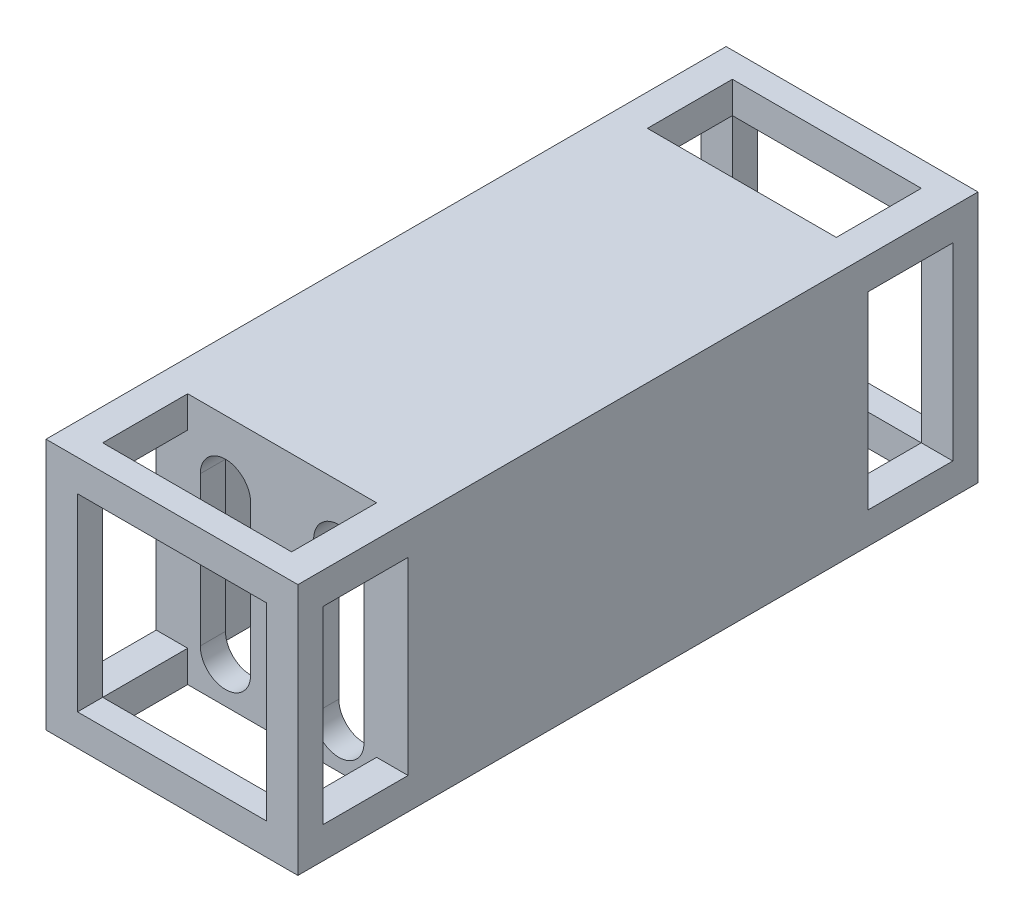
from build123d import *

# Parameters (mm, degrees)
RESSALTO_EXTRUS_O1_DEPTH = 65
ESBO_O2_W                = 40
ESBO_O2_H                = 40
RESSALTO_EXTRUS_O2_DEPTH = 4
ESBO_O4_W                = 5
ESBO_O4_H                = 5
RESSALTO_EXTRUS_O3_DEPTH = 13.5
ESBO_O5_W                = 40
ESBO_O5_H                = 40
ESBO_O5_W_2              = 30
ESBO_O5_H_2              = 30
RESSALTO_EXTRUS_O4_DEPTH = 4


with BuildPart() as part:
    # Esboço1 → Ressalto-extrusão1 (new body)
    with BuildSketch(Plane.XY):
        with BuildLine():
            Line((18, 0), (20, 0))
            Line((20, 0), (20, 40))
            Line((20, 40), (-20, 40))
            Line((-20, 40), (-20, 0))
            Line((-20, 0), (-18, 0))
            Line((-18, 0), (-18, 9))
            Line((-18, 9), (-18, 27))
            ThreePointArc((-18, 27), (-15.363961031, 33.363961031), (-9, 36))
            Line((-9, 36), (9, 36))
            ThreePointArc((9, 36), (15.363961031, 33.363961031), (18, 27))
            Line((18, 27), (18, 0))
        make_face()
    extrude(amount=RESSALTO_EXTRUS_O1_DEPTH)

    # Esboço2 → Ressalto-extrusão2 (add)
    with BuildSketch(Plane(origin=(0, 0, 0), x_dir=(-1, 0, 0), z_dir=(0, 0, -1))):
        with Locations((0, 20)):
            Rectangle(ESBO_O2_W, ESBO_O2_H)
        with BuildLine():
            Line((-5, 30), (-5, 6))
            ThreePointArc((-5, 6), (-9, 2), (-13, 6))
            Line((-13, 6), (-13, 30))
            ThreePointArc((-13, 30), (-9, 34), (-5, 30))
        make_face(mode=Mode.SUBTRACT)
        with BuildLine():
            Line((13, 30), (13, 6.321034479))
            ThreePointArc((13, 6.321034479), (9, 2.321034479), (5, 6.321034479))
            Line((5, 6.321034479), (5, 30))
            ThreePointArc((5, 30), (9, 34), (13, 30))
        make_face(mode=Mode.SUBTRACT)
    ressalto_extrus_o2 = extrude(amount=RESSALTO_EXTRUS_O2_DEPTH)

    # Esboço4 → Ressalto-extrusão3 (add)
    with BuildSketch(Plane(origin=(0, 0, -4), x_dir=(-1, 0, 0), z_dir=(0, 0, -1))):
        with Locations((17.5, 37.5)):
            Rectangle(ESBO_O4_W, ESBO_O4_H)
        with Locations((17.5, 2.5)):
            Rectangle(ESBO_O4_W, ESBO_O4_H)
        with Locations((-17.5, 37.5)):
            Rectangle(ESBO_O4_W, ESBO_O4_H)
        with Locations((-17.5, 2.5)):
            Rectangle(ESBO_O4_W, ESBO_O4_H)
    ressalto_extrus_o3 = extrude(amount=RESSALTO_EXTRUS_O3_DEPTH)

    # Esboço5 → Ressalto-extrusão4 (add)
    with BuildSketch(Plane(origin=(0, 0, -17.5), x_dir=(-1, 0, 0), z_dir=(0, 0, -1))):
        with Locations((0, 20)):
            Rectangle(ESBO_O5_W, ESBO_O5_H)
        with Locations((0, 20)):
            Rectangle(ESBO_O5_W_2, ESBO_O5_H_2, mode=Mode.SUBTRACT)
    ressalto_extrus_o4 = extrude(amount=RESSALTO_EXTRUS_O4_DEPTH)

    # Espelhar1: Ressalto-extrusão2, Ressalto-extrusão3, Ressalto-extrusão4 across plane
    add(ressalto_extrus_o2.mirror(Plane.XY.offset(32.5)))
    add(ressalto_extrus_o3.mirror(Plane.XY.offset(32.5)))
    add(ressalto_extrus_o4.mirror(Plane.XY.offset(32.5)))


solid = part.part
